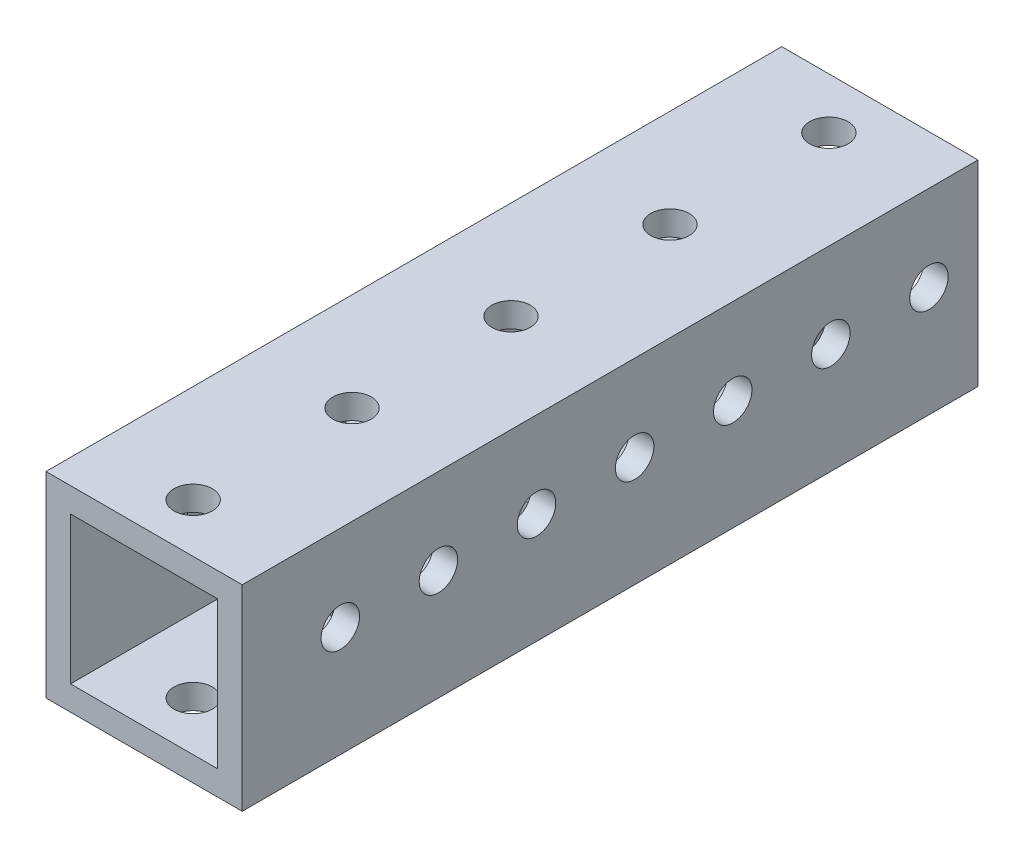
from build123d import *

# Parameters (mm, degrees)
SKETCH1_W           = 25.4
SKETCH1_H           = 25.4
SKETCH1_W_2         = 19.05
SKETCH1_H_2         = 19.05
BOSS_EXTRUDE1_DEPTH = 95.25
SKETCH2_R           = 2.4892
CUT_EXTRUDE1_DEPTH  = 95.25
SKETCH5_R           = 2.4892
CUT_EXTRUDE3_DEPTH  = 95.25


with BuildPart() as part:
    # Sketch1 → Boss-Extrude1 (new body)
    with BuildSketch(Plane.XY):
        with Locations((12.7, 12.7)):
            Rectangle(SKETCH1_W, SKETCH1_H)
        with Locations((12.7, 12.7)):
            Rectangle(SKETCH1_W_2, SKETCH1_H_2, mode=Mode.SUBTRACT)
    extrude(amount=BOSS_EXTRUDE1_DEPTH)

    # Sketch2 → Cut-Extrude1 (cut)
    with BuildSketch(Plane.ZY):
        with Locations((82.55, 14.2875)):
            Circle(SKETCH2_R)
        with Locations((69.85, 14.2875)):
            Circle(SKETCH2_R)
        with Locations((57.15, 14.2875)):
            Circle(SKETCH2_R)
        with Locations((44.45, 14.2875)):
            Circle(SKETCH2_R)
        with Locations((31.75, 14.2875)):
            Circle(SKETCH2_R)
        with Locations((19.05, 14.2875)):
            Circle(SKETCH2_R)
        with Locations((6.35, 14.2875)):
            Circle(SKETCH2_R)
    extrude(amount=-CUT_EXTRUDE1_DEPTH, mode=Mode.SUBTRACT)

    # Sketch5 → Cut-Extrude3 (cut)
    with BuildSketch(Plane(origin=(0, 0, 0), x_dir=(-1, 0, 0), z_dir=(0, -1, 0))):
        with Locations(Location((-12.7, -88.9, 0), (0, 0, 90))):
            Circle(SKETCH5_R)
        with Locations(Location((-12.7, -68.326, 0), (0, 0, 90))):
            Circle(SKETCH5_R)
        with Locations(Location((-12.7, -47.752, 0), (0, 0, 90))):
            Circle(SKETCH5_R)
        with Locations(Location((-12.7, -27.178, 0), (0, 0, 90))):
            Circle(SKETCH5_R)
        with Locations(Location((-12.7, -6.604, 0), (0, 0, 90))):
            Circle(SKETCH5_R)
    extrude(amount=-CUT_EXTRUDE3_DEPTH, mode=Mode.SUBTRACT)


solid = part.part
